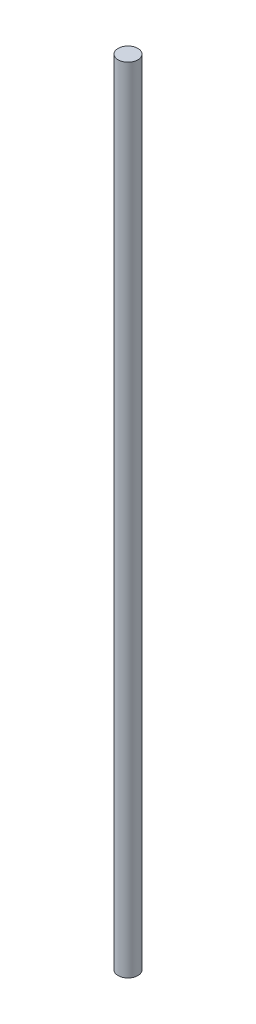
from build123d import *

# Parameters (mm, degrees)
SKETCH1_R           = 0.25
BOSS_EXTRUDE1_DEPTH = 10


with BuildPart() as part:
    # Sketch1 → Boss-Extrude1 (new, symmetric)
    with BuildSketch(Plane(origin=(0, 0, 0), x_dir=(1, 0, 0), z_dir=(0, 1, 0))):
        with Locations(Location((0, 0, 0), (0, 0, 270))):
            Circle(SKETCH1_R)
    extrude(amount=BOSS_EXTRUDE1_DEPTH, both=True)


solid = part.part
